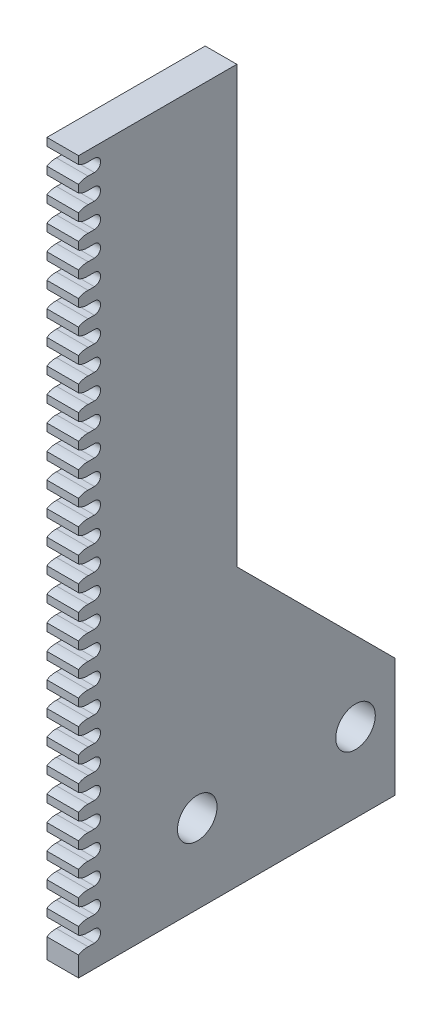
from build123d import *

# Parameters (mm, degrees)
SKETCH_1_R             = 2.5
EXTRUDE_1_DEPTH        = 4
CUT_EXTRUDE_1_DEPTH    = 4
PATTERN_LINEAR_1_COUNT = 28
PATTERN_LINEAR_1_PITCH = 3.123741803


with BuildPart() as part:
    # Эскиз1 → Бобышка-Вытянуть1 (new body)
    with BuildSketch(Plane(origin=(0, 0, 0), x_dir=(0, 0, -1), z_dir=(1, 0, 0))):
        Polygon((40, 15), (20, 35), (20, 90), (0, 90), (0, 0), (40, 0), align=None)
        with Locations((15, 10)):
            Circle(SKETCH_1_R, mode=Mode.SUBTRACT)
        with Locations((35, 10)):
            Circle(SKETCH_1_R, mode=Mode.SUBTRACT)
    extrude(amount=EXTRUDE_1_DEPTH)

    # Эскиз2 → Вырез-Вытянуть1 (cut)
    with BuildSketch(Plane(origin=(4, 0, 0), x_dir=(0, 0, -1), z_dir=(1, 0, 0))):
        with BuildLine():
            Line((0, 4.678130057), (0, 2.514522863))
            add(Edge.make_bspline(
                [(1.207101889, 2.81539101), (0.550592434, 2.842200567), (0, 2.514522863)],
                knots=[0, 0, 0, 1, 1, 1], degree=2))
            Line((1.207101889, 2.81539101), (2, 2.81539101))
            ThreePointArc((2, 2.81539101), (2.78093545, 3.59632646), (2, 4.37726191))
            Line((2, 4.37726191), (1.207101889, 4.37726191))
            add(Edge.make_bspline(
                [(1.207101889, 4.37726191), (0.550592434, 4.350452352), (0, 4.678130057)],
                knots=[0, 0, 0, 1, 1, 1], degree=2))
        make_face()
    cut_extrude_1 = extrude(amount=-CUT_EXTRUDE_1_DEPTH, mode=Mode.SUBTRACT)

    # Линейный массив1: Вырез-Вытянуть1 ×28
    with Locations(*[(0, i * PATTERN_LINEAR_1_PITCH, 0) for i in range(1, PATTERN_LINEAR_1_COUNT)]):
        add(cut_extrude_1, mode=Mode.SUBTRACT)


solid = part.part
